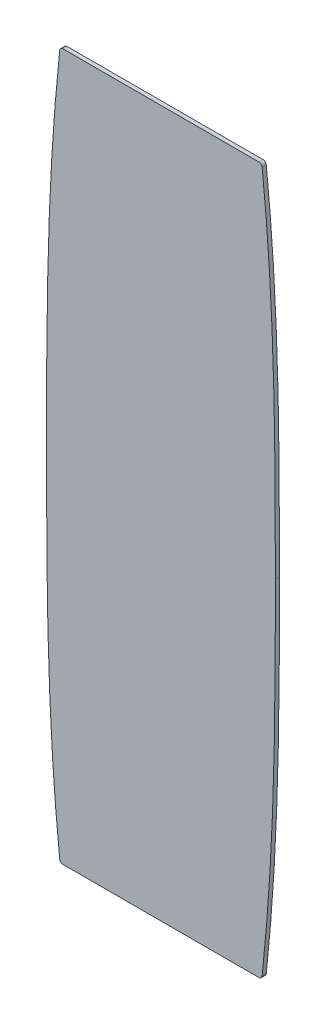
from build123d import *

# Parameters (mm, degrees)
BOSS_EXTRUDE1_DEPTH = 1


with BuildPart() as part:
    # Sketch1 → Boss-Extrude1 (new body)
    with BuildSketch(Plane.XY):
        with BuildLine():
            Line((-23.795886894, -85.79999998), (23.795886554, -85.8))
            ThreePointArc((23.795886554, -85.8), (24.330859001, -85.594814662), (24.59141021, -85.084511206))
            add(Edge.make_bspline(
                [(24.59141021, -85.084511206), (25.341468128, -78.024041397), (25.932408266, -70.950161412), (26.828664767, -56.778329557), (27.135080896, -49.685975803), (27.551790648, -35.492442071), (27.662965311, -28.394595165), (27.787446712, -14.197895926), (27.8, -7.09901507), (27.8, 0)],
                knots=[0, 0, 0, 0, 0.25, 0.25, 0.5, 0.5, 0.75, 0.75, 1, 1, 1, 1], degree=3))
            add(Edge.make_bspline(
                [(27.8, 0), (27.8, 7.100263374), (27.787445727, 14.200482559), (27.66289227, 28.400570909), (27.551614497, 35.499737802), (27.134760595, 49.694574965), (26.827273573, 56.785620292), (26.155946103, 67.408536005), (25.897541639, 70.947263524), (25.302724282, 78.019662606), (24.966538048, 81.553348858), (24.59141053, 85.084511211)],
                knots=[0, 0, 0, 0, 0.25, 0.25, 0.5, 0.5, 0.75, 0.75, 0.875, 0.875, 1, 1, 1, 1], degree=3))
            ThreePointArc((24.59141053, 85.084511211), (24.330859338, 85.594814664), (23.795886894, 85.79999998))
            Line((23.795886894, 85.79999998), (-23.795886554, 85.800000019))
            ThreePointArc((-23.795886554, 85.800000019), (-24.330859013, 85.594814676), (-24.59141021, 85.084511206))
            add(Edge.make_bspline(
                [(-24.59141021, 85.084511206), (-25.341468128, 78.024041397), (-25.932408265, 70.950161412), (-26.828664767, 56.778329556), (-27.135080896, 49.685975803), (-27.551790648, 35.492442071), (-27.662965311, 28.394595165), (-27.787446711, 14.197895926), (-27.8, 7.09901507), (-27.8, 0)],
                knots=[0, 0, 0, 0, 0.25, 0.25, 0.5, 0.5, 0.75, 0.75, 1, 1, 1, 1], degree=3))
            add(Edge.make_bspline(
                [(-27.8, 0), (-27.8, -7.100263374), (-27.787445727, -14.200482559), (-27.66289227, -28.400570909), (-27.551614497, -35.499737802), (-27.134760595, -49.694574965), (-26.827273573, -56.785620292), (-26.155946103, -67.408536005), (-25.897541639, -70.947263524), (-25.302724282, -78.019662606), (-24.966538048, -81.553348858), (-24.59141053, -85.084511211)],
                knots=[0, 0, 0, 0, 0.25, 0.25, 0.5, 0.5, 0.75, 0.75, 0.875, 0.875, 1, 1, 1, 1], degree=3))
            ThreePointArc((-24.59141053, -85.084511211), (-24.330859338, -85.594814664), (-23.795886894, -85.79999998))
        make_face()
    extrude(amount=BOSS_EXTRUDE1_DEPTH)


solid = part.part
